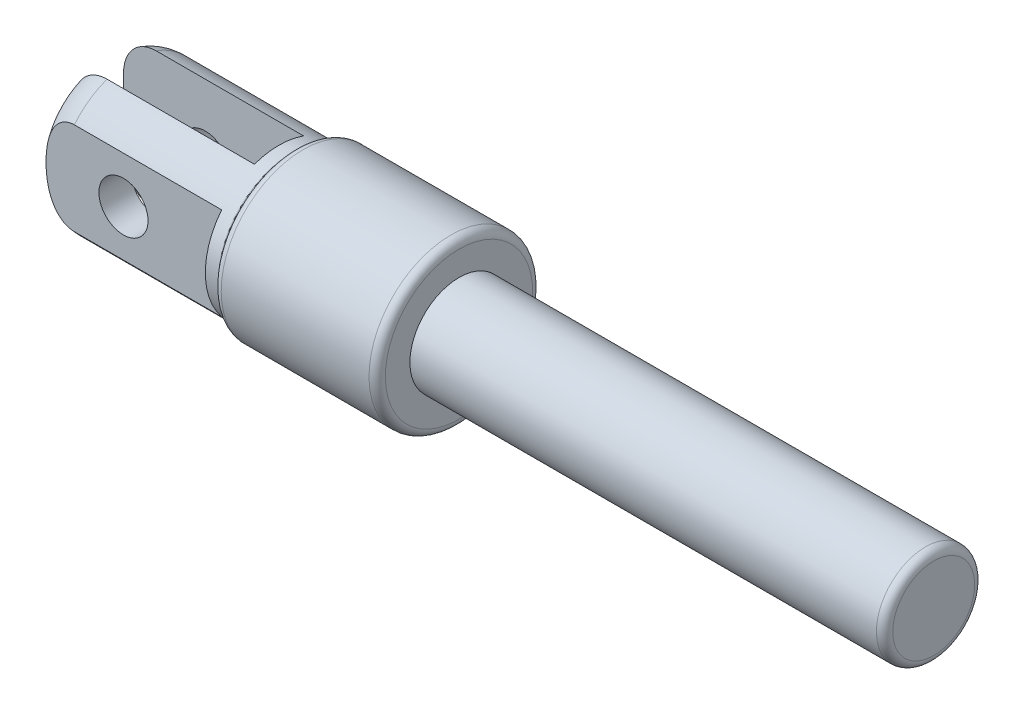
from build123d import *

# Parameters (mm, degrees)
FILLET_1_R          = 2
SKETCH_2_R          = 7.321356554
SKETCH_2_W          = 2
SKETCH_2_H          = 11.961651185
CUT_EXTRUDE_1_DEPTH = 11
CUT_EXTRUDE_2_REACH = 53.945
SKETCH_3_R          = 1.5
FILLET_2_R          = 0.2
FILLET_3_R          = 0.5
FILLET_4_R          = 0.5


with BuildPart() as part:
    # 草图1 → 旋转1 (revolve)
    with BuildSketch(Plane.XY):
        Polygon((0, 0), (0, 3), (-29, 3), (-29, 5), (-39, 5), (-39, 4.5), (-51, 4.5), (-51, 0), align=None)
    revolve(axis=Axis((0, 0, 0), (-1, 0, 0)))

    # 圆角1
    fillet_1_edges = [part.edges().sort_by_distance(p)[0] for p in [
        (-51, -4.5, 0),
    ]]
    fillet(fillet_1_edges, radius=FILLET_1_R)

    # 草图2 → 切除-拉伸1 (cut)
    with BuildSketch(Plane.ZY.offset(51)):
        Circle(SKETCH_2_R)
        with Locations((2.5, -0.178000761)):
            Rectangle(SKETCH_2_W, SKETCH_2_H, mode=Mode.SUBTRACT)
        with Locations((-2.5, -0.178000761)):
            Rectangle(SKETCH_2_W, SKETCH_2_H, mode=Mode.SUBTRACT)
    extrude(amount=-CUT_EXTRUDE_1_DEPTH, mode=Mode.SUBTRACT)

    # 切除-拉伸2: up to this face of the body (flat: up to its plane)
    cut_extrude_2_end = Plane(part.part.faces().sort_by_distance((-45.204174513, -1.4e-08, -3.5))[0])
    # 草图3 → 切除-拉伸2 (cut, up to the picked face)
    with BuildSketch(Plane.XY.offset(3.5), mode=Mode.PRIVATE) as cut_extrude_2_sk1:
        with Locations(Location((-46, 0, 0), (0, 0, 270))):
            Circle(SKETCH_3_R)
    cut_extrude_2_tool1 = split(extrude(cut_extrude_2_sk1.sketch, amount=-CUT_EXTRUDE_2_REACH, mode=Mode.PRIVATE), bisect_by=cut_extrude_2_end, keep=Keep.BOTH, mode=Mode.PRIVATE)
    add(cut_extrude_2_tool1.solids().sort_by(Axis((-46, 0, 3.5), (0, 0, -1)))[0], mode=Mode.SUBTRACT)

    # 圆角2
    fillet_2_edges = [part.edges().sort_by_distance(p)[0] for p in [
        (-39, -4.5, 0),
    ]]
    fillet(fillet_2_edges, radius=FILLET_2_R)

    # 圆角3
    fillet_3_edges = [part.edges().sort_by_distance(p)[0] for p in [
        (0, -3, 0),
    ]]
    fillet(fillet_3_edges, radius=FILLET_3_R)

    # 圆角4
    fillet_4_edges = [part.edges().sort_by_distance(p)[0] for p in [
        (-29, -5, 0),
        (-39, -5, 0),
    ]]
    fillet(fillet_4_edges, radius=FILLET_4_R)


solid = part.part
